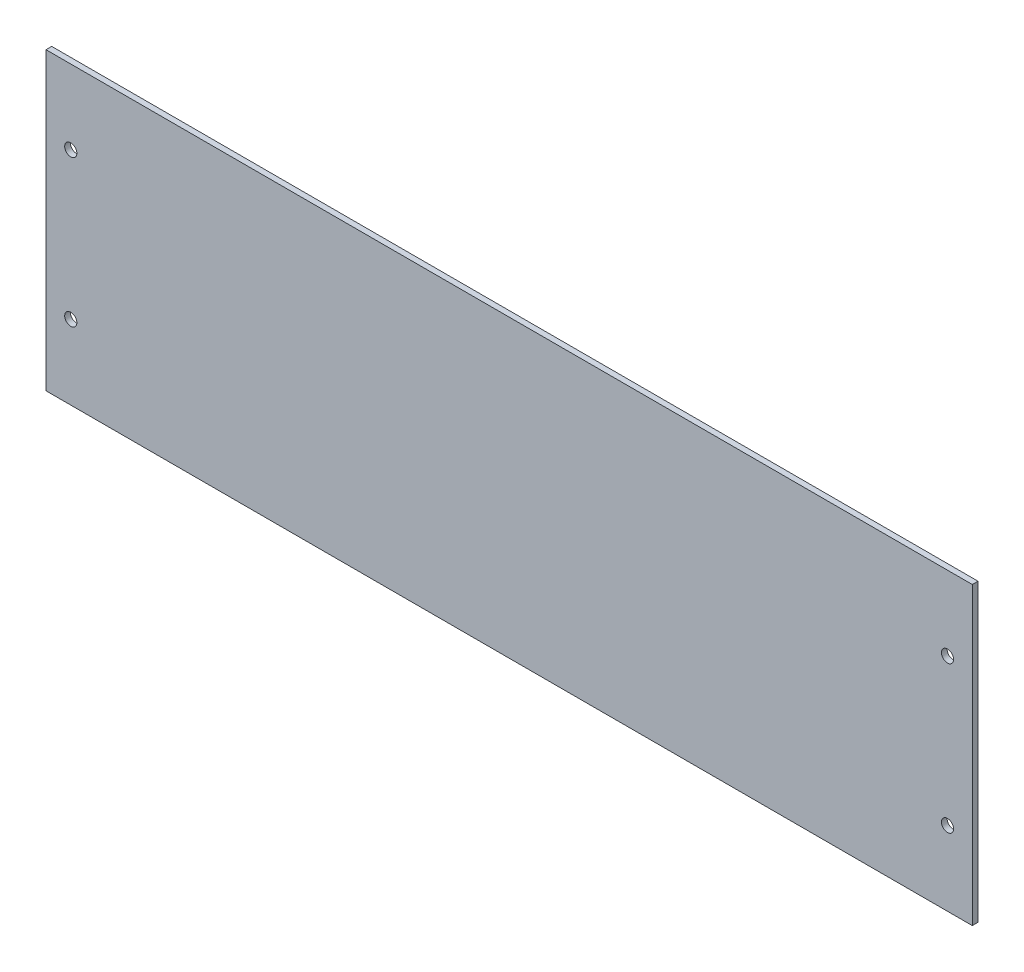
from build123d import *

# Parameters (mm, degrees)
SKETCH1_W           = 243
SKETCH1_H           = 77.5
SKETCH1_R           = 1.6
BOSS_EXTRUDE1_DEPTH = 1.5


with BuildPart() as part:
    # Sketch1 → Boss-Extrude1 (new body)
    with BuildSketch(Plane.XY):
        with Locations((53.469343532, 37.524359285)):
            Rectangle(SKETCH1_W, SKETCH1_H)
        with Locations((-61.530656468, 56.774359285)):
            Circle(SKETCH1_R, mode=Mode.SUBTRACT)
        with Locations((-61.530656468, 18.274359285)):
            Circle(SKETCH1_R, mode=Mode.SUBTRACT)
        with Locations(Location((168.469343532, 18.274359285, 0), (0, 0, 180))):
            Circle(SKETCH1_R, mode=Mode.SUBTRACT)
        with Locations(Location((168.469343532, 56.774359285, 0), (0, 0, 180))):
            Circle(SKETCH1_R, mode=Mode.SUBTRACT)
    extrude(amount=BOSS_EXTRUDE1_DEPTH)


solid = part.part
